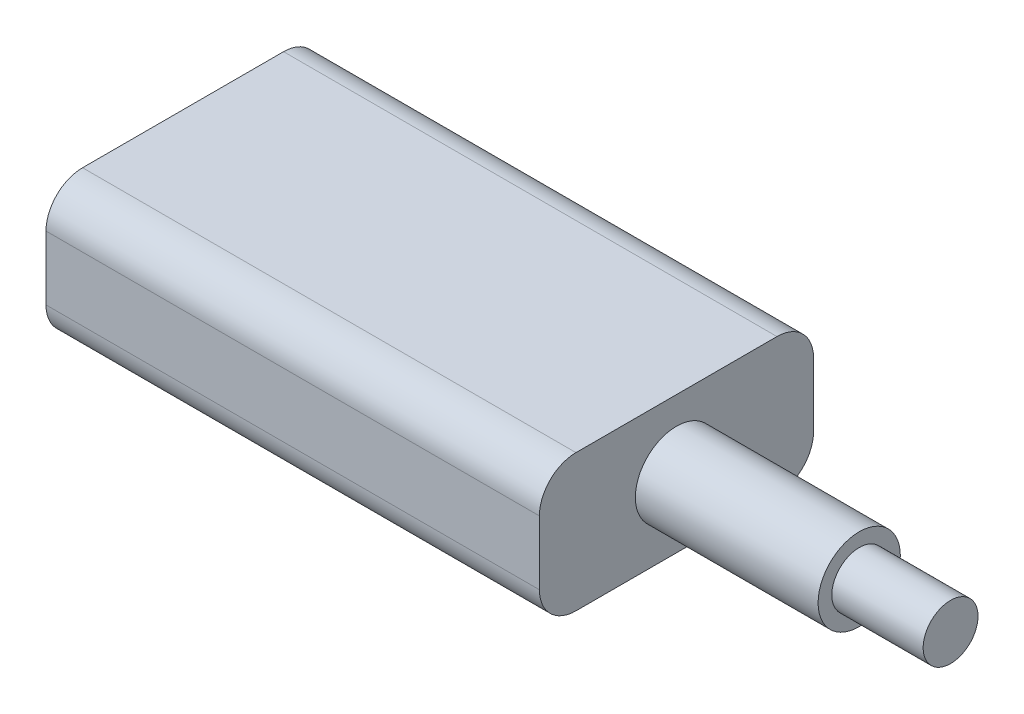
from build123d import *

# Parameters (mm, degrees)
SKETCH_1_W          = 27
SKETCH_1_H          = 15
EXTRUDE_1_DEPTH     = 7.5
SKETCH_2_R          = 2.25
EXTRUDE_2_DEPTH     = 10
SKETCH_3_R          = 1.5
EXTRUDE_3_DEPTH     = 5
FILLET_1_R          = 2
SKETCH_4_W          = 11
SKETCH_4_H          = 3
CUT_EXTRUDE_1_DEPTH = 10


with BuildPart() as part:
    # Эскиз1 → Бобышка-Вытянуть1 (new body)
    with BuildSketch(Plane(origin=(0, 0, 0), x_dir=(1, 0, 0), z_dir=(0, 1, 0))):
        with Locations((13.5, 7.5)):
            Rectangle(SKETCH_1_W, SKETCH_1_H)
    extrude(amount=EXTRUDE_1_DEPTH)

    # Эскиз2 → Бобышка-Вытянуть2 (add)
    with BuildSketch(Plane(origin=(27, 0, 0), x_dir=(0, 0, -1), z_dir=(1, 0, 0))):
        with Locations(Location((7.5, 3.75, 0), (0, 0, 180))):
            Circle(SKETCH_2_R)
    extrude(amount=EXTRUDE_2_DEPTH)

    # Эскиз3 → Бобышка-Вытянуть3 (add)
    with BuildSketch(Plane(origin=(37, 0, 0), x_dir=(0, 0, -1), z_dir=(1, 0, 0))):
        with Locations((7.5, 3.75)):
            Circle(SKETCH_3_R)
    extrude(amount=EXTRUDE_3_DEPTH)

    # Скругление1
    fillet_1_edges = [part.edges().sort_by_distance(p)[0] for p in [
        (13.5, 7.5, -15),
        (13.5, 7.5, 0),
        (13.5, 0, -15),
        (13.5, 0, 0),
    ]]
    fillet(fillet_1_edges, radius=FILLET_1_R)

    # Эскиз4 → Вырез-Вытянуть1 (cut)
    with BuildSketch(Plane.ZY):
        with Locations((-7.5, 5)):
            Rectangle(SKETCH_4_W, SKETCH_4_H)
    extrude(amount=-CUT_EXTRUDE_1_DEPTH, mode=Mode.SUBTRACT)


solid = part.part
